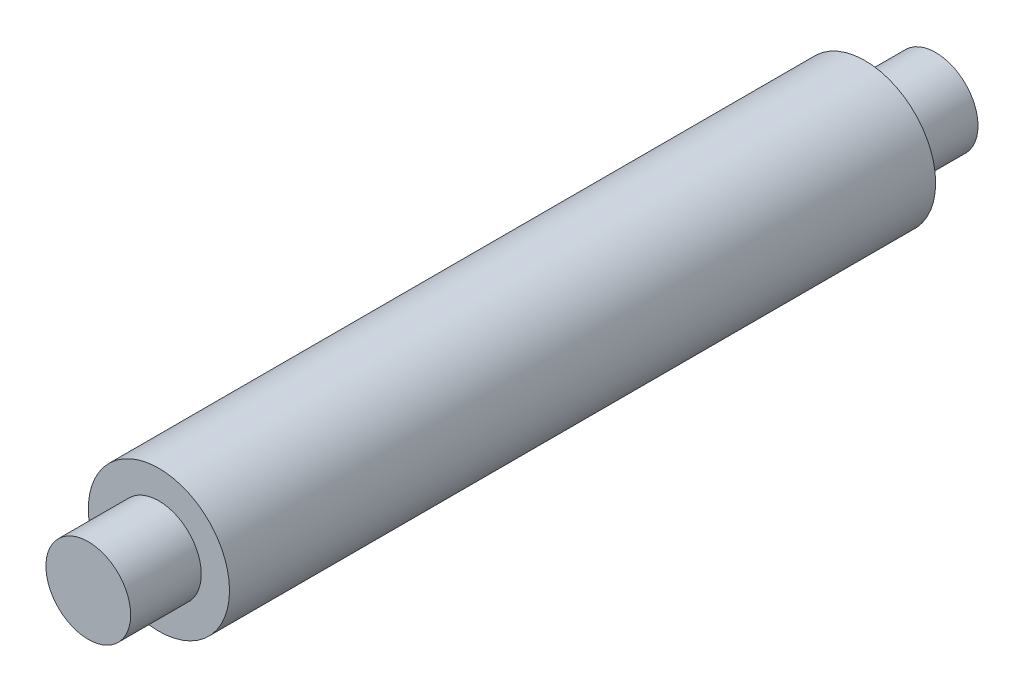
from build123d import *

# Parameters (mm, degrees)
SKETCH2_R           = 10
BOSS_EXTRUDE2_DEPTH = 60
CUT_EXTRUDE1_START  = -10
SKETCH3_R           = 10
SKETCH3_R_2         = 6
CUT_EXTRUDE1_DEPTH  = 10


with BuildPart() as part:
    # Sketch2 → Boss-Extrude2 (new body)
    with BuildSketch(Plane.XY):
        Circle(SKETCH2_R)
    boss_extrude2 = extrude(amount=BOSS_EXTRUDE2_DEPTH)

    # Sketch3 → Cut-Extrude1 (cut)
    with BuildSketch(Plane.XY.offset(60).offset(CUT_EXTRUDE1_START)):
        Circle(SKETCH3_R)
        Circle(SKETCH3_R_2, mode=Mode.SUBTRACT)
    cut_extrude1 = extrude(amount=CUT_EXTRUDE1_DEPTH, mode=Mode.SUBTRACT)

    # Mirror2: Boss-Extrude2, Cut-Extrude1 across plane
    add(boss_extrude2.mirror(Plane.XY))
    add(cut_extrude1.mirror(Plane.XY), mode=Mode.SUBTRACT)


solid = part.part
